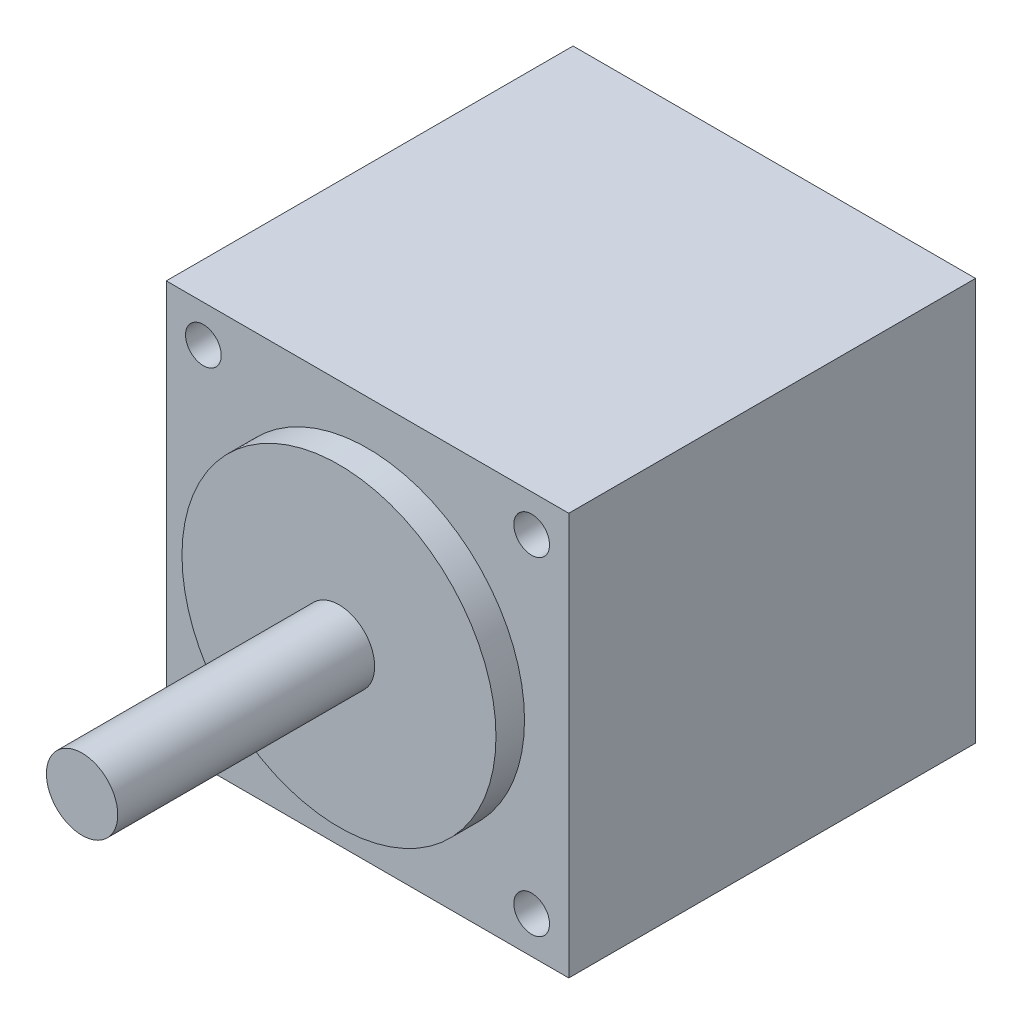
from build123d import *

# Parameters (mm, degrees)
SKETCH1_R           = 2.5
BOSS_EXTRUDE1_DEPTH = 20
SKETCH1_3_R         = 11
BOSS_EXTRUDE2_DEPTH = 2
SKETCH1_4_W         = 28.2
SKETCH1_4_H         = 28.2
SKETCH1_4_R         = 1.25
SKETCH1_4_R_2       = 11
BOSS_EXTRUDE3_DEPTH = 28.5


with BuildPart() as part:
    # Sketch1 → Boss-Extrude1 (new body)
    with BuildSketch(Plane.XY):
        Circle(SKETCH1_R)
    extrude(amount=BOSS_EXTRUDE1_DEPTH)

    # Sketch1<3> → Boss-Extrude2 (add)
    with BuildSketch(Plane.XY):
        Circle(SKETCH1_3_R)
    extrude(amount=BOSS_EXTRUDE2_DEPTH)


with BuildPart() as body_2:
    # Sketch1<4> → Boss-Extrude3 (new body)
    with BuildSketch(Plane.XY):
        Rectangle(SKETCH1_4_W, SKETCH1_4_H)
        with Locations((-11.5, -11.5)):
            Circle(SKETCH1_4_R, mode=Mode.SUBTRACT)
        with Locations((11.5, -11.5)):
            Circle(SKETCH1_4_R, mode=Mode.SUBTRACT)
        Circle(SKETCH1_4_R_2, mode=Mode.SUBTRACT)
        with Locations((-11.5, 11.5)):
            Circle(SKETCH1_4_R, mode=Mode.SUBTRACT)
        with Locations((11.5, 11.5)):
            Circle(SKETCH1_4_R, mode=Mode.SUBTRACT)
    extrude(amount=-BOSS_EXTRUDE3_DEPTH)


solid = Compound([part.part, body_2.part])
